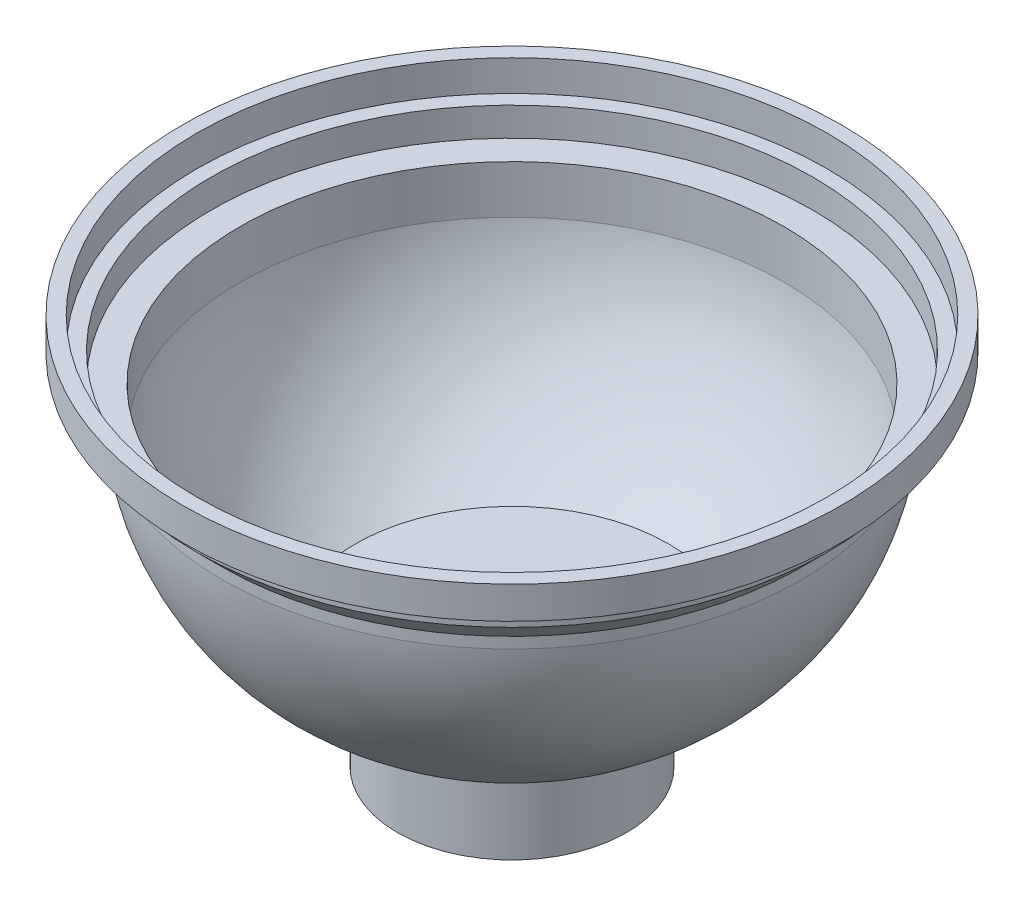
from build123d import *


with BuildPart() as part:
    # Esquisse1 → Révolution1 (revolve)
    with BuildSketch(Plane.XY, mode=Mode.PRIVATE) as r_volution1_sk:
        with BuildLine():
            Line((30, 35), (30, 0))
            Line((30, 0), (40, 0))
            Line((40, 0), (40, 30))
            Line((40, 30), (45.778995681, 30))
            ThreePointArc((45.778995681, 30), (84.314223985, 60.59839034), (100.998111547, 106.889568849))
            Line((100.998111547, 106.889568849), (100.998111547, 110.707348445))
            Line((100.998111547, 110.707348445), (110.337667118, 120.046904015))
            Line((110.337667118, 120.046904015), (110.337667118, 125.152560563))
            Line((110.337667118, 125.152560563), (115, 125.152560563))
            Line((115, 125.152560563), (115, 136.391053218))
            Line((115, 136.391053218), (110, 136.391053218))
            Line((110, 136.391053218), (110, 125.608667149))
            Line((110, 125.608667149), (105, 125.608667149))
            Line((105, 125.608667149), (105, 115.608667149))
            Line((105, 115.608667149), (95, 115.608667149))
            Line((95, 115.608667149), (95, 98.791773656))
            ThreePointArc((95, 98.791773656), (81.262363234, 64.951540679), (54.592067969, 40))
            Line((54.592067969, 40), (15, 40))
            Line((15, 40), (15, 35))
            Line((15, 35), (30, 35))
        make_face()
    revolve(r_volution1_sk.sketch.rotate(Axis((0, 50.463576159, 0), (0, -1, 0)), 90), axis=Axis((0, 50.463576159, 0), (0, -1, 0)))


solid = part.part
